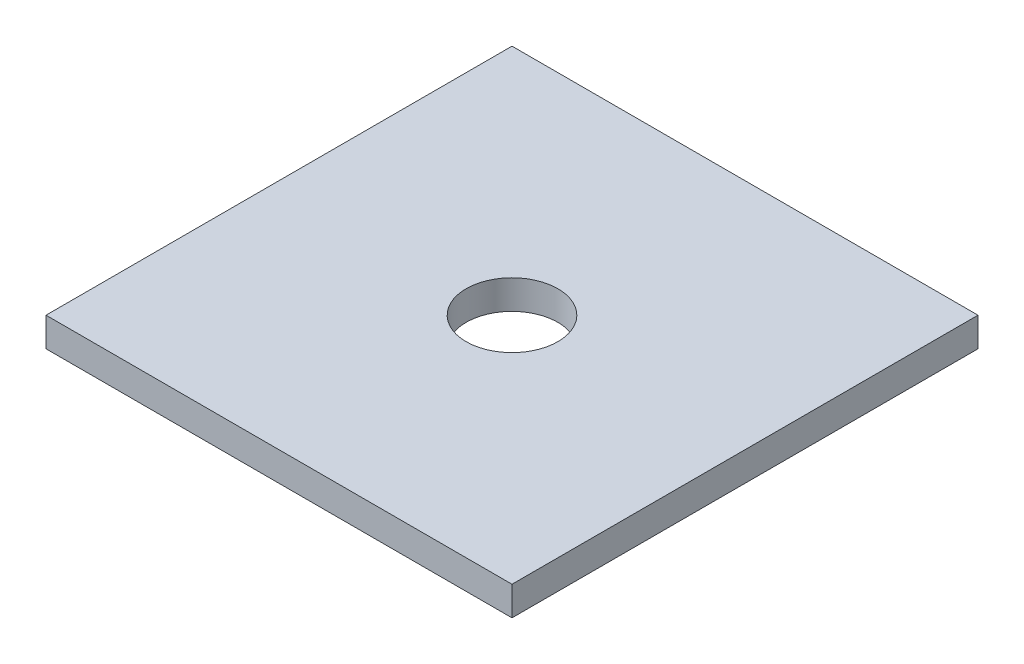
from build123d import *

# Parameters (mm, degrees)
SKETCH1_W           = 101.6
SKETCH1_H           = 101.6
SKETCH1_R           = 10
BOSS_EXTRUDE1_DEPTH = 6.35


with BuildPart() as part:
    # Sketch1 → Boss-Extrude1 (new body)
    with BuildSketch(Plane(origin=(0, 0, 0), x_dir=(1, 0, 0), z_dir=(0, 1, 0))):
        Rectangle(SKETCH1_W, SKETCH1_H)
        with Locations(Location((0, 0, 0), (0, 0, 270))):
            Circle(SKETCH1_R, mode=Mode.SUBTRACT)
    extrude(amount=BOSS_EXTRUDE1_DEPTH)


solid = part.part
